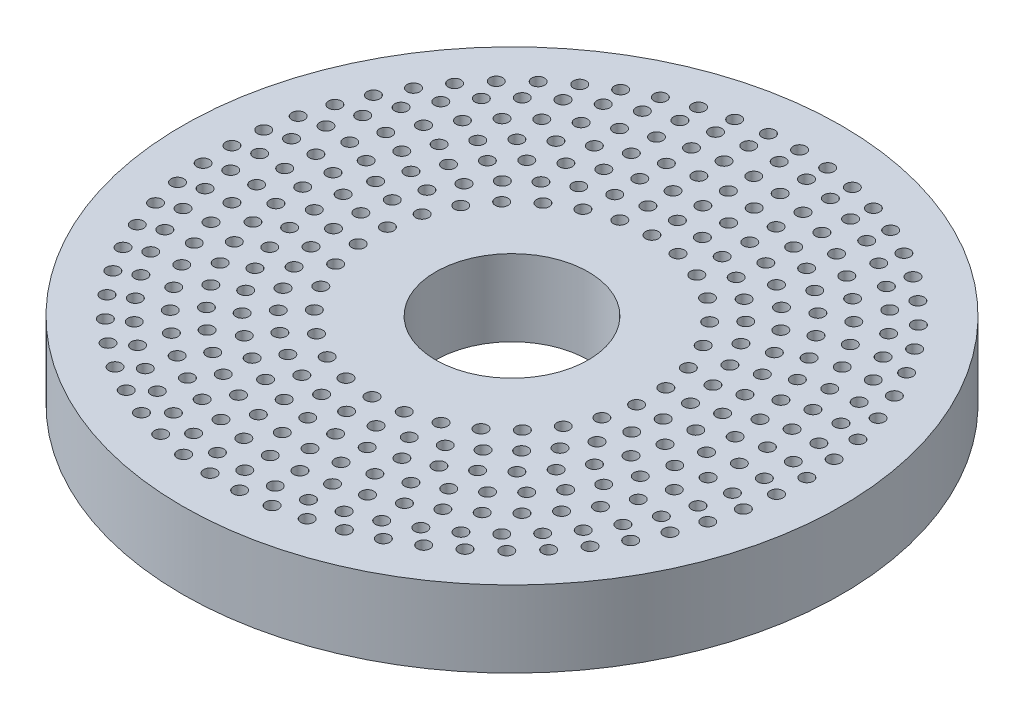
from build123d import *

# Parameters (mm, degrees)
IZIM1_R                     = 129.5
IZIM1_R_2                   = 2.5
Y_KSEKLIK_EKSTR_ZYON2_DEPTH = 30
IZIM2_R                     = 30
KES_EKSTR_ZYON1_DEPTH       = 30


with BuildPart() as part:
    # Çizim1 → Yükseklik-Ekstrüzyon2 (new body)
    with BuildSketch(Plane(origin=(0, 0, 0), x_dir=(1, 0, 0), z_dir=(0, 1, 0))):
        with Locations(Location((0, 0, 0), (0, 0, 270))):
            Circle(IZIM1_R)
        with Locations(Location((0, 55, 0), (0, 0, 270))):
            Circle(IZIM1_R_2, mode=Mode.SUBTRACT)
        with Locations(Location((0, 65, 0), (0, 0, 270))):
            Circle(IZIM1_R_2, mode=Mode.SUBTRACT)
        with Locations(Location((0, 75, 0), (0, 0, 270))):
            Circle(IZIM1_R_2, mode=Mode.SUBTRACT)
        with Locations(Location((0, 85, 0), (0, 0, 270))):
            Circle(IZIM1_R_2, mode=Mode.SUBTRACT)
        with Locations(Location((0, 95, 0), (0, 0, 270))):
            Circle(IZIM1_R_2, mode=Mode.SUBTRACT)
        with Locations(Location((0, 105, 0), (0, 0, 270))):
            Circle(IZIM1_R_2, mode=Mode.SUBTRACT)
        with Locations(Location((0, 113, 0), (0, 0, 270))):
            Circle(IZIM1_R_2, mode=Mode.SUBTRACT)
        with Locations(Location((11.435142995, 53.79811804, 0), (0, 0, 270))):
            Circle(IZIM1_R_2, mode=Mode.SUBTRACT)
        with Locations(Location((22.370515369, 50.24500017, 0), (0, 0, 270))):
            Circle(IZIM1_R_2, mode=Mode.SUBTRACT)
        with Locations(Location((32.328188876, 44.495934691, 0), (0, 0, 270))):
            Circle(IZIM1_R_2, mode=Mode.SUBTRACT)
        with Locations(Location((40.872965401, 36.80218335, 0), (0, 0, 270))):
            Circle(IZIM1_R_2, mode=Mode.SUBTRACT)
        with Locations(Location((47.631397208, 27.5, 0), (0, 0, 270))):
            Circle(IZIM1_R_2, mode=Mode.SUBTRACT)
        with Locations(Location((52.308108396, 16.995934691, 0), (0, 0, 270))):
            Circle(IZIM1_R_2, mode=Mode.SUBTRACT)
        with Locations(Location((54.698704245, 5.74906548, 0), (0, 0, 270))):
            Circle(IZIM1_R_2, mode=Mode.SUBTRACT)
        with Locations(Location((54.698704245, -5.74906548, 0), (0, 0, 270))):
            Circle(IZIM1_R_2, mode=Mode.SUBTRACT)
        with Locations(Location((52.308108396, -16.995934691, 0), (0, 0, 270))):
            Circle(IZIM1_R_2, mode=Mode.SUBTRACT)
        with Locations(Location((47.631397208, -27.5, 0), (0, 0, 270))):
            Circle(IZIM1_R_2, mode=Mode.SUBTRACT)
        with Locations(Location((40.872965401, -36.80218335, 0), (0, 0, 270))):
            Circle(IZIM1_R_2, mode=Mode.SUBTRACT)
        with Locations(Location((32.328188876, -44.495934691, 0), (0, 0, 270))):
            Circle(IZIM1_R_2, mode=Mode.SUBTRACT)
        with Locations(Location((22.370515369, -50.24500017, 0), (0, 0, 270))):
            Circle(IZIM1_R_2, mode=Mode.SUBTRACT)
        with Locations(Location((11.435142995, -53.79811804, 0), (0, 0, 270))):
            Circle(IZIM1_R_2, mode=Mode.SUBTRACT)
        with Locations(Location((0, -55, 0), (0, 0, 270))):
            Circle(IZIM1_R_2, mode=Mode.SUBTRACT)
        with Locations(Location((-11.435142995, -53.79811804, 0), (0, 0, 270))):
            Circle(IZIM1_R_2, mode=Mode.SUBTRACT)
        with Locations(Location((-22.370515369, -50.24500017, 0), (0, 0, 270))):
            Circle(IZIM1_R_2, mode=Mode.SUBTRACT)
        with Locations(Location((-32.328188876, -44.495934691, 0), (0, 0, 270))):
            Circle(IZIM1_R_2, mode=Mode.SUBTRACT)
        with Locations(Location((-40.872965401, -36.80218335, 0), (0, 0, 270))):
            Circle(IZIM1_R_2, mode=Mode.SUBTRACT)
        with Locations(Location((-47.631397208, -27.5, 0), (0, 0, 270))):
            Circle(IZIM1_R_2, mode=Mode.SUBTRACT)
        with Locations(Location((-52.308108396, -16.995934691, 0), (0, 0, 270))):
            Circle(IZIM1_R_2, mode=Mode.SUBTRACT)
        with Locations(Location((-54.698704245, -5.74906548, 0), (0, 0, 270))):
            Circle(IZIM1_R_2, mode=Mode.SUBTRACT)
        with Locations(Location((-54.698704245, 5.74906548, 0), (0, 0, 270))):
            Circle(IZIM1_R_2, mode=Mode.SUBTRACT)
        with Locations(Location((-52.308108396, 16.995934691, 0), (0, 0, 270))):
            Circle(IZIM1_R_2, mode=Mode.SUBTRACT)
        with Locations(Location((-47.631397208, 27.5, 0), (0, 0, 270))):
            Circle(IZIM1_R_2, mode=Mode.SUBTRACT)
        with Locations(Location((-40.872965401, 36.80218335, 0), (0, 0, 270))):
            Circle(IZIM1_R_2, mode=Mode.SUBTRACT)
        with Locations(Location((-32.328188876, 44.495934691, 0), (0, 0, 270))):
            Circle(IZIM1_R_2, mode=Mode.SUBTRACT)
        with Locations(Location((-22.370515369, 50.24500017, 0), (0, 0, 270))):
            Circle(IZIM1_R_2, mode=Mode.SUBTRACT)
        with Locations(Location((-11.435142995, 53.79811804, 0), (0, 0, 270))):
            Circle(IZIM1_R_2, mode=Mode.SUBTRACT)
        with Locations(Location((10.698648368, 64.113484721, 0), (0, 0, 270))):
            Circle(IZIM1_R_2, mode=Mode.SUBTRACT)
        with Locations(Location((21.105465498, 61.478120711, 0), (0, 0, 270))):
            Circle(IZIM1_R_2, mode=Mode.SUBTRACT)
        with Locations(Location((30.936580547, 57.165793828, 0), (0, 0, 270))):
            Circle(IZIM1_R_2, mode=Mode.SUBTRACT)
        with Locations(Location((39.923826325, 51.294133111, 0), (0, 0, 270))):
            Circle(IZIM1_R_2, mode=Mode.SUBTRACT)
        with Locations(Location((47.822054194, 44.023302156, 0), (0, 0, 270))):
            Circle(IZIM1_R_2, mode=Mode.SUBTRACT)
        with Locations(Location((54.415821087, 35.551630278, 0), (0, 0, 270))):
            Circle(IZIM1_R_2, mode=Mode.SUBTRACT)
        with Locations(Location((59.525266233, 26.110202602, 0), (0, 0, 270))):
            Circle(IZIM1_R_2, mode=Mode.SUBTRACT)
        with Locations(Location((63.011017286, 15.956556664, 0), (0, 0, 270))):
            Circle(IZIM1_R_2, mode=Mode.SUBTRACT)
        with Locations(Location((64.777992045, 5.367657456, 0), (0, 0, 270))):
            Circle(IZIM1_R_2, mode=Mode.SUBTRACT)
        with Locations(Location((64.777992045, -5.367657456, 0), (0, 0, 270))):
            Circle(IZIM1_R_2, mode=Mode.SUBTRACT)
        with Locations(Location((63.011017286, -15.956556664, 0), (0, 0, 270))):
            Circle(IZIM1_R_2, mode=Mode.SUBTRACT)
        with Locations(Location((59.525266233, -26.110202602, 0), (0, 0, 270))):
            Circle(IZIM1_R_2, mode=Mode.SUBTRACT)
        with Locations(Location((54.415821087, -35.551630278, 0), (0, 0, 270))):
            Circle(IZIM1_R_2, mode=Mode.SUBTRACT)
        with Locations(Location((47.822054194, -44.023302156, 0), (0, 0, 270))):
            Circle(IZIM1_R_2, mode=Mode.SUBTRACT)
        with Locations(Location((39.923826325, -51.294133111, 0), (0, 0, 270))):
            Circle(IZIM1_R_2, mode=Mode.SUBTRACT)
        with Locations(Location((30.936580547, -57.165793828, 0), (0, 0, 270))):
            Circle(IZIM1_R_2, mode=Mode.SUBTRACT)
        with Locations(Location((21.105465498, -61.478120711, 0), (0, 0, 270))):
            Circle(IZIM1_R_2, mode=Mode.SUBTRACT)
        with Locations(Location((10.698648368, -64.113484721, 0), (0, 0, 270))):
            Circle(IZIM1_R_2, mode=Mode.SUBTRACT)
        with Locations(Location((0, -65, 0), (0, 0, 270))):
            Circle(IZIM1_R_2, mode=Mode.SUBTRACT)
        with Locations(Location((-10.698648368, -64.113484721, 0), (0, 0, 270))):
            Circle(IZIM1_R_2, mode=Mode.SUBTRACT)
        with Locations(Location((-21.105465498, -61.478120711, 0), (0, 0, 270))):
            Circle(IZIM1_R_2, mode=Mode.SUBTRACT)
        with Locations(Location((-30.936580547, -57.165793828, 0), (0, 0, 270))):
            Circle(IZIM1_R_2, mode=Mode.SUBTRACT)
        with Locations(Location((-39.923826325, -51.294133111, 0), (0, 0, 270))):
            Circle(IZIM1_R_2, mode=Mode.SUBTRACT)
        with Locations(Location((-47.822054194, -44.023302156, 0), (0, 0, 270))):
            Circle(IZIM1_R_2, mode=Mode.SUBTRACT)
        with Locations(Location((-54.415821087, -35.551630278, 0), (0, 0, 270))):
            Circle(IZIM1_R_2, mode=Mode.SUBTRACT)
        with Locations(Location((-59.525266233, -26.110202602, 0), (0, 0, 270))):
            Circle(IZIM1_R_2, mode=Mode.SUBTRACT)
        with Locations(Location((-63.011017286, -15.956556664, 0), (0, 0, 270))):
            Circle(IZIM1_R_2, mode=Mode.SUBTRACT)
        with Locations(Location((-64.777992045, -5.367657456, 0), (0, 0, 270))):
            Circle(IZIM1_R_2, mode=Mode.SUBTRACT)
        with Locations(Location((-64.777992045, 5.367657456, 0), (0, 0, 270))):
            Circle(IZIM1_R_2, mode=Mode.SUBTRACT)
        with Locations(Location((-63.011017286, 15.956556664, 0), (0, 0, 270))):
            Circle(IZIM1_R_2, mode=Mode.SUBTRACT)
        with Locations(Location((-59.525266233, 26.110202602, 0), (0, 0, 270))):
            Circle(IZIM1_R_2, mode=Mode.SUBTRACT)
        with Locations(Location((-54.415821087, 35.551630278, 0), (0, 0, 270))):
            Circle(IZIM1_R_2, mode=Mode.SUBTRACT)
        with Locations(Location((-47.822054194, 44.023302156, 0), (0, 0, 270))):
            Circle(IZIM1_R_2, mode=Mode.SUBTRACT)
        with Locations(Location((-39.923826325, 51.294133111, 0), (0, 0, 270))):
            Circle(IZIM1_R_2, mode=Mode.SUBTRACT)
        with Locations(Location((-30.936580547, 57.165793828, 0), (0, 0, 270))):
            Circle(IZIM1_R_2, mode=Mode.SUBTRACT)
        with Locations(Location((-21.105465498, 61.478120711, 0), (0, 0, 270))):
            Circle(IZIM1_R_2, mode=Mode.SUBTRACT)
        with Locations(Location((-10.698648368, 64.113484721, 0), (0, 0, 270))):
            Circle(IZIM1_R_2, mode=Mode.SUBTRACT)
        with Locations(Location((10.92008758, 74.200752606, 0), (0, 0, 270))):
            Circle(IZIM1_R_2, mode=Mode.SUBTRACT)
        with Locations(Location((21.607432452, 71.820044993, 0), (0, 0, 270))):
            Circle(IZIM1_R_2, mode=Mode.SUBTRACT)
        with Locations(Location((31.834252416, 67.908617812, 0), (0, 0, 270))):
            Circle(IZIM1_R_2, mode=Mode.SUBTRACT)
        with Locations(Location((41.382580558, 62.549836342, 0), (0, 0, 270))):
            Circle(IZIM1_R_2, mode=Mode.SUBTRACT)
        with Locations(Location((50.048910842, 55.857913706, 0), (0, 0, 270))):
            Circle(IZIM1_R_2, mode=Mode.SUBTRACT)
        with Locations(Location((57.648535483, 47.975476617, 0), (0, 0, 270))):
            Circle(IZIM1_R_2, mode=Mode.SUBTRACT)
        with Locations(Location((64.019481678, 39.070525537, 0), (0, 0, 270))):
            Circle(IZIM1_R_2, mode=Mode.SUBTRACT)
        with Locations(Location((69.025963768, 29.332854037, 0), (0, 0, 270))):
            Circle(IZIM1_R_2, mode=Mode.SUBTRACT)
        with Locations(Location((72.561277279, 18.970003679, 0), (0, 0, 270))):
            Circle(IZIM1_R_2, mode=Mode.SUBTRACT)
        with Locations(Location((74.550073143, 8.202840628, 0), (0, 0, 270))):
            Circle(IZIM1_R_2, mode=Mode.SUBTRACT)
        with Locations(Location((74.949963628, -2.739151729, 0), (0, 0, 270))):
            Circle(IZIM1_R_2, mode=Mode.SUBTRACT)
        with Locations(Location((73.752425762, -13.622763823, 0), (0, 0, 270))):
            Circle(IZIM1_R_2, mode=Mode.SUBTRACT)
        with Locations(Location((70.982982987, -24.216030358, 0), (0, 0, 270))):
            Circle(IZIM1_R_2, mode=Mode.SUBTRACT)
        with Locations(Location((66.700661166, -34.293174248, 0), (0, 0, 270))):
            Circle(IZIM1_R_2, mode=Mode.SUBTRACT)
        with Locations(Location((60.996730555, -43.639418667, 0), (0, 0, 270))):
            Circle(IZIM1_R_2, mode=Mode.SUBTRACT)
        with Locations(Location((53.992760532, -52.055564642, 0), (0, 0, 270))):
            Circle(IZIM1_R_2, mode=Mode.SUBTRACT)
        with Locations(Location((45.838028557, -59.362236632, 0), (0, 0, 270))):
            Circle(IZIM1_R_2, mode=Mode.SUBTRACT)
        with Locations(Location((36.706338586, -65.403705611, 0), (0, 0, 270))):
            Circle(IZIM1_R_2, mode=Mode.SUBTRACT)
        with Locations(Location((26.792316735, -70.051208155, 0), (0, 0, 270))):
            Circle(IZIM1_R_2, mode=Mode.SUBTRACT)
        with Locations(Location((16.307263169, -73.205690817, 0), (0, 0, 270))):
            Circle(IZIM1_R_2, mode=Mode.SUBTRACT)
        with Locations(Location((5.4746486, -74.799921275, 0), (0, 0, 270))):
            Circle(IZIM1_R_2, mode=Mode.SUBTRACT)
        with Locations(Location((-5.4746486, -74.799921275, 0), (0, 0, 270))):
            Circle(IZIM1_R_2, mode=Mode.SUBTRACT)
        with Locations(Location((-16.307263169, -73.205690817, 0), (0, 0, 270))):
            Circle(IZIM1_R_2, mode=Mode.SUBTRACT)
        with Locations(Location((-26.792316735, -70.051208155, 0), (0, 0, 270))):
            Circle(IZIM1_R_2, mode=Mode.SUBTRACT)
        with Locations(Location((-36.706338586, -65.403705611, 0), (0, 0, 270))):
            Circle(IZIM1_R_2, mode=Mode.SUBTRACT)
        with Locations(Location((-45.838028557, -59.362236632, 0), (0, 0, 270))):
            Circle(IZIM1_R_2, mode=Mode.SUBTRACT)
        with Locations(Location((-53.992760532, -52.055564642, 0), (0, 0, 270))):
            Circle(IZIM1_R_2, mode=Mode.SUBTRACT)
        with Locations(Location((-60.996730555, -43.639418667, 0), (0, 0, 270))):
            Circle(IZIM1_R_2, mode=Mode.SUBTRACT)
        with Locations(Location((-66.700661166, -34.293174248, 0), (0, 0, 270))):
            Circle(IZIM1_R_2, mode=Mode.SUBTRACT)
        with Locations(Location((-70.982982987, -24.216030358, 0), (0, 0, 270))):
            Circle(IZIM1_R_2, mode=Mode.SUBTRACT)
        with Locations(Location((-73.752425762, -13.622763823, 0), (0, 0, 270))):
            Circle(IZIM1_R_2, mode=Mode.SUBTRACT)
        with Locations(Location((-74.949963628, -2.739151729, 0), (0, 0, 270))):
            Circle(IZIM1_R_2, mode=Mode.SUBTRACT)
        with Locations(Location((-74.550073143, 8.202840628, 0), (0, 0, 270))):
            Circle(IZIM1_R_2, mode=Mode.SUBTRACT)
        with Locations(Location((-72.561277279, 18.970003679, 0), (0, 0, 270))):
            Circle(IZIM1_R_2, mode=Mode.SUBTRACT)
        with Locations(Location((-69.025963768, 29.332854037, 0), (0, 0, 270))):
            Circle(IZIM1_R_2, mode=Mode.SUBTRACT)
        with Locations(Location((-64.019481678, 39.070525537, 0), (0, 0, 270))):
            Circle(IZIM1_R_2, mode=Mode.SUBTRACT)
        with Locations(Location((-57.648535483, 47.975476617, 0), (0, 0, 270))):
            Circle(IZIM1_R_2, mode=Mode.SUBTRACT)
        with Locations(Location((-50.048910842, 55.857913706, 0), (0, 0, 270))):
            Circle(IZIM1_R_2, mode=Mode.SUBTRACT)
        with Locations(Location((-41.382580558, 62.549836342, 0), (0, 0, 270))):
            Circle(IZIM1_R_2, mode=Mode.SUBTRACT)
        with Locations(Location((-31.834252416, 67.908617812, 0), (0, 0, 270))):
            Circle(IZIM1_R_2, mode=Mode.SUBTRACT)
        with Locations(Location((-21.607432452, 71.820044993, 0), (0, 0, 270))):
            Circle(IZIM1_R_2, mode=Mode.SUBTRACT)
        with Locations(Location((-10.92008758, 74.200752606, 0), (0, 0, 270))):
            Circle(IZIM1_R_2, mode=Mode.SUBTRACT)
        with Locations(Location((10.869558743, 84.302151175, 0), (0, 0, 270))):
            Circle(IZIM1_R_2, mode=Mode.SUBTRACT)
        with Locations(Location((21.560639632, 82.220063358, 0), (0, 0, 270))):
            Circle(IZIM1_R_2, mode=Mode.SUBTRACT)
        with Locations(Location((31.897695415, 78.787924374, 0), (0, 0, 270))):
            Circle(IZIM1_R_2, mode=Mode.SUBTRACT)
        with Locations(Location((41.71099192, 74.06208985, 0), (0, 0, 270))):
            Circle(IZIM1_R_2, mode=Mode.SUBTRACT)
        with Locations(Location((50.839395092, 68.120157859, 0), (0, 0, 270))):
            Circle(IZIM1_R_2, mode=Mode.SUBTRACT)
        with Locations(Location((59.133016801, 61.059694758, 0), (0, 0, 270))):
            Circle(IZIM1_R_2, mode=Mode.SUBTRACT)
        with Locations(Location((66.45567601, 52.996633158, 0), (0, 0, 270))):
            Circle(IZIM1_R_2, mode=Mode.SUBTRACT)
        with Locations(Location((72.687134855, 44.063368306, 0), (0, 0, 270))):
            Circle(IZIM1_R_2, mode=Mode.SUBTRACT)
        with Locations(Location((77.725072956, 34.406584165, 0), (0, 0, 270))):
            Circle(IZIM1_R_2, mode=Mode.SUBTRACT)
        with Locations(Location((81.486767508, 24.184844864, 0), (0, 0, 270))):
            Circle(IZIM1_R_2, mode=Mode.SUBTRACT)
        with Locations(Location((83.91045159, 13.565991078, 0), (0, 0, 270))):
            Circle(IZIM1_R_2, mode=Mode.SUBTRACT)
        with Locations(Location((84.956328377, 2.724384094, 0), (0, 0, 270))):
            Circle(IZIM1_R_2, mode=Mode.SUBTRACT)
        with Locations(Location((84.607224601, -8.161957202, 0), (0, 0, 270))):
            Circle(IZIM1_R_2, mode=Mode.SUBTRACT)
        with Locations(Location((82.868872535, -18.914279386, 0), (0, 0, 270))):
            Circle(IZIM1_R_2, mode=Mode.SUBTRACT)
        with Locations(Location((79.769815874, -29.356029626, 0), (0, 0, 270))):
            Circle(IZIM1_R_2, mode=Mode.SUBTRACT)
        with Locations(Location((75.360941042, -39.31575467, 0), (0, 0, 270))):
            Circle(IZIM1_R_2, mode=Mode.SUBTRACT)
        with Locations(Location((69.714641641, -48.62991611, 0), (0, 0, 270))):
            Circle(IZIM1_R_2, mode=Mode.SUBTRACT)
        with Locations(Location((62.923629751, -57.145575672, 0), (0, 0, 270))):
            Circle(IZIM1_R_2, mode=Mode.SUBTRACT)
        with Locations(Location((55.099413601, -64.722906461, 0), (0, 0, 270))):
            Circle(IZIM1_R_2, mode=Mode.SUBTRACT)
        with Locations(Location((46.370466603, -71.237488916, 0), (0, 0, 270))):
            Circle(IZIM1_R_2, mode=Mode.SUBTRACT)
        with Locations(Location((36.880117825, -76.582353772, 0), (0, 0, 270))):
            Circle(IZIM1_R_2, mode=Mode.SUBTRACT)
        with Locations(Location((26.784198532, -80.669738496, 0), (0, 0, 270))):
            Circle(IZIM1_R_2, mode=Mode.SUBTRACT)
        with Locations(Location((16.24848344, -83.432528344, 0), (0, 0, 270))):
            Circle(IZIM1_R_2, mode=Mode.SUBTRACT)
        with Locations(Location((5.445968698, -84.825358384, 0), (0, 0, 270))):
            Circle(IZIM1_R_2, mode=Mode.SUBTRACT)
        with Locations(Location((-5.445968698, -84.825358384, 0), (0, 0, 270))):
            Circle(IZIM1_R_2, mode=Mode.SUBTRACT)
        with Locations(Location((-16.24848344, -83.432528344, 0), (0, 0, 270))):
            Circle(IZIM1_R_2, mode=Mode.SUBTRACT)
        with Locations(Location((-26.784198532, -80.669738496, 0), (0, 0, 270))):
            Circle(IZIM1_R_2, mode=Mode.SUBTRACT)
        with Locations(Location((-36.880117825, -76.582353772, 0), (0, 0, 270))):
            Circle(IZIM1_R_2, mode=Mode.SUBTRACT)
        with Locations(Location((-46.370466603, -71.237488916, 0), (0, 0, 270))):
            Circle(IZIM1_R_2, mode=Mode.SUBTRACT)
        with Locations(Location((-55.099413601, -64.722906461, 0), (0, 0, 270))):
            Circle(IZIM1_R_2, mode=Mode.SUBTRACT)
        with Locations(Location((-62.923629751, -57.145575672, 0), (0, 0, 270))):
            Circle(IZIM1_R_2, mode=Mode.SUBTRACT)
        with Locations(Location((-69.714641641, -48.62991611, 0), (0, 0, 270))):
            Circle(IZIM1_R_2, mode=Mode.SUBTRACT)
        with Locations(Location((-75.360941042, -39.31575467, 0), (0, 0, 270))):
            Circle(IZIM1_R_2, mode=Mode.SUBTRACT)
        with Locations(Location((-79.769815874, -29.356029626, 0), (0, 0, 270))):
            Circle(IZIM1_R_2, mode=Mode.SUBTRACT)
        with Locations(Location((-82.868872535, -18.914279386, 0), (0, 0, 270))):
            Circle(IZIM1_R_2, mode=Mode.SUBTRACT)
        with Locations(Location((-84.607224601, -8.161957202, 0), (0, 0, 270))):
            Circle(IZIM1_R_2, mode=Mode.SUBTRACT)
        with Locations(Location((-84.956328377, 2.724384094, 0), (0, 0, 270))):
            Circle(IZIM1_R_2, mode=Mode.SUBTRACT)
        with Locations(Location((-83.91045159, 13.565991078, 0), (0, 0, 270))):
            Circle(IZIM1_R_2, mode=Mode.SUBTRACT)
        with Locations(Location((-81.486767508, 24.184844864, 0), (0, 0, 270))):
            Circle(IZIM1_R_2, mode=Mode.SUBTRACT)
        with Locations(Location((-77.725072956, 34.406584165, 0), (0, 0, 270))):
            Circle(IZIM1_R_2, mode=Mode.SUBTRACT)
        with Locations(Location((-72.687134855, 44.063368306, 0), (0, 0, 270))):
            Circle(IZIM1_R_2, mode=Mode.SUBTRACT)
        with Locations(Location((-66.45567601, 52.996633158, 0), (0, 0, 270))):
            Circle(IZIM1_R_2, mode=Mode.SUBTRACT)
        with Locations(Location((-59.133016801, 61.059694758, 0), (0, 0, 270))):
            Circle(IZIM1_R_2, mode=Mode.SUBTRACT)
        with Locations(Location((-50.839395092, 68.120157859, 0), (0, 0, 270))):
            Circle(IZIM1_R_2, mode=Mode.SUBTRACT)
        with Locations(Location((-41.71099192, 74.06208985, 0), (0, 0, 270))):
            Circle(IZIM1_R_2, mode=Mode.SUBTRACT)
        with Locations(Location((-31.897695415, 78.787924374, 0), (0, 0, 270))):
            Circle(IZIM1_R_2, mode=Mode.SUBTRACT)
        with Locations(Location((-21.560639632, 82.220063358, 0), (0, 0, 270))):
            Circle(IZIM1_R_2, mode=Mode.SUBTRACT)
        with Locations(Location((-10.869558743, 84.302151175, 0), (0, 0, 270))):
            Circle(IZIM1_R_2, mode=Mode.SUBTRACT)
        with Locations(Location((11.028826842, 94.357643985, 0), (0, 0, 270))):
            Circle(IZIM1_R_2, mode=Mode.SUBTRACT)
        with Locations(Location((21.908507721, 92.439262705, 0), (0, 0, 270))):
            Circle(IZIM1_R_2, mode=Mode.SUBTRACT)
        with Locations(Location((32.491913616, 89.270798975, 0), (0, 0, 270))):
            Circle(IZIM1_R_2, mode=Mode.SUBTRACT)
        with Locations(Location((42.635922119, 84.895100831, 0), (0, 0, 270))):
            Circle(IZIM1_R_2, mode=Mode.SUBTRACT)
        with Locations(Location((52.203352917, 79.371342084, 0), (0, 0, 270))):
            Circle(IZIM1_R_2, mode=Mode.SUBTRACT)
        with Locations(Location((61.06482292, 72.774222096, 0), (0, 0, 270))):
            Circle(IZIM1_R_2, mode=Mode.SUBTRACT)
        with Locations(Location((69.100495949, 65.192955598, 0), (0, 0, 270))):
            Circle(IZIM1_R_2, mode=Mode.SUBTRACT)
        with Locations(Location((76.201703312, 56.730066212, 0), (0, 0, 270))):
            Circle(IZIM1_R_2, mode=Mode.SUBTRACT)
        with Locations(Location((82.27241336, 47.5, 0), (0, 0, 270))):
            Circle(IZIM1_R_2, mode=Mode.SUBTRACT)
        with Locations(Location((87.230530154, 37.627577774, 0), (0, 0, 270))):
            Circle(IZIM1_R_2, mode=Mode.SUBTRACT)
        with Locations(Location((91.00900367, 27.246307108, 0), (0, 0, 270))):
            Circle(IZIM1_R_2, mode=Mode.SUBTRACT)
        with Locations(Location((93.556736536, 16.496576878, 0), (0, 0, 270))):
            Circle(IZIM1_R_2, mode=Mode.SUBTRACT)
        with Locations(Location((94.839275036, 5.523758747, 0), (0, 0, 270))):
            Circle(IZIM1_R_2, mode=Mode.SUBTRACT)
        with Locations(Location((94.839275036, -5.523758746, 0), (0, 0, 270))):
            Circle(IZIM1_R_2, mode=Mode.SUBTRACT)
        with Locations(Location((93.556736536, -16.496576878, 0), (0, 0, 270))):
            Circle(IZIM1_R_2, mode=Mode.SUBTRACT)
        with Locations(Location((91.00900367, -27.246307108, 0), (0, 0, 270))):
            Circle(IZIM1_R_2, mode=Mode.SUBTRACT)
        with Locations(Location((87.230530154, -37.627577774, 0), (0, 0, 270))):
            Circle(IZIM1_R_2, mode=Mode.SUBTRACT)
        with Locations(Location((82.27241336, -47.5, 0), (0, 0, 270))):
            Circle(IZIM1_R_2, mode=Mode.SUBTRACT)
        with Locations(Location((76.201703312, -56.730066212, 0), (0, 0, 270))):
            Circle(IZIM1_R_2, mode=Mode.SUBTRACT)
        with Locations(Location((69.100495949, -65.192955598, 0), (0, 0, 270))):
            Circle(IZIM1_R_2, mode=Mode.SUBTRACT)
        with Locations(Location((61.06482292, -72.774222096, 0), (0, 0, 270))):
            Circle(IZIM1_R_2, mode=Mode.SUBTRACT)
        with Locations(Location((52.203352917, -79.371342084, 0), (0, 0, 270))):
            Circle(IZIM1_R_2, mode=Mode.SUBTRACT)
        with Locations(Location((42.635922119, -84.895100831, 0), (0, 0, 270))):
            Circle(IZIM1_R_2, mode=Mode.SUBTRACT)
        with Locations(Location((32.491913616, -89.270798975, 0), (0, 0, 270))):
            Circle(IZIM1_R_2, mode=Mode.SUBTRACT)
        with Locations(Location((21.908507721, -92.439262705, 0), (0, 0, 270))):
            Circle(IZIM1_R_2, mode=Mode.SUBTRACT)
        with Locations(Location((11.028826842, -94.357643985, 0), (0, 0, 270))):
            Circle(IZIM1_R_2, mode=Mode.SUBTRACT)
        with Locations(Location((0, -95, 0), (0, 0, 270))):
            Circle(IZIM1_R_2, mode=Mode.SUBTRACT)
        with Locations(Location((-11.028826842, -94.357643985, 0), (0, 0, 270))):
            Circle(IZIM1_R_2, mode=Mode.SUBTRACT)
        with Locations(Location((-21.908507721, -92.439262705, 0), (0, 0, 270))):
            Circle(IZIM1_R_2, mode=Mode.SUBTRACT)
        with Locations(Location((-32.491913616, -89.270798975, 0), (0, 0, 270))):
            Circle(IZIM1_R_2, mode=Mode.SUBTRACT)
        with Locations(Location((-42.635922119, -84.895100831, 0), (0, 0, 270))):
            Circle(IZIM1_R_2, mode=Mode.SUBTRACT)
        with Locations(Location((-52.203352917, -79.371342084, 0), (0, 0, 270))):
            Circle(IZIM1_R_2, mode=Mode.SUBTRACT)
        with Locations(Location((-61.06482292, -72.774222096, 0), (0, 0, 270))):
            Circle(IZIM1_R_2, mode=Mode.SUBTRACT)
        with Locations(Location((-69.100495949, -65.192955598, 0), (0, 0, 270))):
            Circle(IZIM1_R_2, mode=Mode.SUBTRACT)
        with Locations(Location((-76.201703312, -56.730066212, 0), (0, 0, 270))):
            Circle(IZIM1_R_2, mode=Mode.SUBTRACT)
        with Locations(Location((-82.272413359, -47.5, 0), (0, 0, 270))):
            Circle(IZIM1_R_2, mode=Mode.SUBTRACT)
        with Locations(Location((-87.230530154, -37.627577774, 0), (0, 0, 270))):
            Circle(IZIM1_R_2, mode=Mode.SUBTRACT)
        with Locations(Location((-91.00900367, -27.246307108, 0), (0, 0, 270))):
            Circle(IZIM1_R_2, mode=Mode.SUBTRACT)
        with Locations(Location((-93.556736536, -16.496576878, 0), (0, 0, 270))):
            Circle(IZIM1_R_2, mode=Mode.SUBTRACT)
        with Locations(Location((-94.839275036, -5.523758747, 0), (0, 0, 270))):
            Circle(IZIM1_R_2, mode=Mode.SUBTRACT)
        with Locations(Location((-94.839275036, 5.523758746, 0), (0, 0, 270))):
            Circle(IZIM1_R_2, mode=Mode.SUBTRACT)
        with Locations(Location((-93.556736536, 16.496576878, 0), (0, 0, 270))):
            Circle(IZIM1_R_2, mode=Mode.SUBTRACT)
        with Locations(Location((-91.00900367, 27.246307108, 0), (0, 0, 270))):
            Circle(IZIM1_R_2, mode=Mode.SUBTRACT)
        with Locations(Location((-87.230530154, 37.627577774, 0), (0, 0, 270))):
            Circle(IZIM1_R_2, mode=Mode.SUBTRACT)
        with Locations(Location((-82.27241336, 47.5, 0), (0, 0, 270))):
            Circle(IZIM1_R_2, mode=Mode.SUBTRACT)
        with Locations(Location((-76.201703312, 56.730066212, 0), (0, 0, 270))):
            Circle(IZIM1_R_2, mode=Mode.SUBTRACT)
        with Locations(Location((-69.100495949, 65.192955598, 0), (0, 0, 270))):
            Circle(IZIM1_R_2, mode=Mode.SUBTRACT)
        with Locations(Location((-61.06482292, 72.774222096, 0), (0, 0, 270))):
            Circle(IZIM1_R_2, mode=Mode.SUBTRACT)
        with Locations(Location((-52.203352917, 79.371342084, 0), (0, 0, 270))):
            Circle(IZIM1_R_2, mode=Mode.SUBTRACT)
        with Locations(Location((-42.635922119, 84.895100831, 0), (0, 0, 270))):
            Circle(IZIM1_R_2, mode=Mode.SUBTRACT)
        with Locations(Location((-32.491913616, 89.270798975, 0), (0, 0, 270))):
            Circle(IZIM1_R_2, mode=Mode.SUBTRACT)
        with Locations(Location((-21.908507721, 92.439262705, 0), (0, 0, 270))):
            Circle(IZIM1_R_2, mode=Mode.SUBTRACT)
        with Locations(Location((-11.028826842, 94.357643985, 0), (0, 0, 270))):
            Circle(IZIM1_R_2, mode=Mode.SUBTRACT)
        with Locations(Location((11.352496935, 104.384485501, 0), (0, 0, 270))):
            Circle(IZIM1_R_2, mode=Mode.SUBTRACT)
        with Locations(Location((22.571896222, 102.54515835, 0), (0, 0, 270))):
            Circle(IZIM1_R_2, mode=Mode.SUBTRACT)
        with Locations(Location((33.526660664, 99.503582974, 0), (0, 0, 270))):
            Circle(IZIM1_R_2, mode=Mode.SUBTRACT)
        with Locations(Location((44.088355664, 95.295419065, 0), (0, 0, 270))):
            Circle(IZIM1_R_2, mode=Mode.SUBTRACT)
        with Locations(Location((54.133155004, 89.970003498, 0), (0, 0, 270))):
            Circle(IZIM1_R_2, mode=Mode.SUBTRACT)
        with Locations(Location((63.543292595, 83.589771899, 0), (0, 0, 270))):
            Circle(IZIM1_R_2, mode=Mode.SUBTRACT)
        with Locations(Location((72.20844318, 76.229526652, 0), (0, 0, 270))):
            Circle(IZIM1_R_2, mode=Mode.SUBTRACT)
        with Locations(Location((80.027015788, 67.975559902, 0), (0, 0, 270))):
            Circle(IZIM1_R_2, mode=Mode.SUBTRACT)
        with Locations(Location((86.907344806, 58.924641863, 0), (0, 0, 270))):
            Circle(IZIM1_R_2, mode=Mode.SUBTRACT)
        with Locations(Location((92.768764667, 49.182886273, 0), (0, 0, 270))):
            Circle(IZIM1_R_2, mode=Mode.SUBTRACT)
        with Locations(Location((97.542555581, 38.864506311, 0), (0, 0, 270))):
            Circle(IZIM1_R_2, mode=Mode.SUBTRACT)
        with Locations(Location((101.172749215, 28.090475546, 0), (0, 0, 270))):
            Circle(IZIM1_R_2, mode=Mode.SUBTRACT)
        with Locations(Location((103.616784867, 16.987109638, 0), (0, 0, 270))):
            Circle(IZIM1_R_2, mode=Mode.SUBTRACT)
        with Locations(Location((104.846008454, 5.684585401, 0), (0, 0, 270))):
            Circle(IZIM1_R_2, mode=Mode.SUBTRACT)
        with Locations(Location((104.846008454, -5.684585401, 0), (0, 0, 270))):
            Circle(IZIM1_R_2, mode=Mode.SUBTRACT)
        with Locations(Location((103.616784867, -16.987109638, 0), (0, 0, 270))):
            Circle(IZIM1_R_2, mode=Mode.SUBTRACT)
        with Locations(Location((101.172749215, -28.090475546, 0), (0, 0, 270))):
            Circle(IZIM1_R_2, mode=Mode.SUBTRACT)
        with Locations(Location((97.542555581, -38.864506311, 0), (0, 0, 270))):
            Circle(IZIM1_R_2, mode=Mode.SUBTRACT)
        with Locations(Location((92.768764667, -49.182886273, 0), (0, 0, 270))):
            Circle(IZIM1_R_2, mode=Mode.SUBTRACT)
        with Locations(Location((86.907344806, -58.924641863, 0), (0, 0, 270))):
            Circle(IZIM1_R_2, mode=Mode.SUBTRACT)
        with Locations(Location((80.027015788, -67.975559902, 0), (0, 0, 270))):
            Circle(IZIM1_R_2, mode=Mode.SUBTRACT)
        with Locations(Location((72.20844318, -76.229526652, 0), (0, 0, 270))):
            Circle(IZIM1_R_2, mode=Mode.SUBTRACT)
        with Locations(Location((63.543292595, -83.589771899, 0), (0, 0, 270))):
            Circle(IZIM1_R_2, mode=Mode.SUBTRACT)
        with Locations(Location((54.133155004, -89.970003498, 0), (0, 0, 270))):
            Circle(IZIM1_R_2, mode=Mode.SUBTRACT)
        with Locations(Location((44.088355664, -95.295419065, 0), (0, 0, 270))):
            Circle(IZIM1_R_2, mode=Mode.SUBTRACT)
        with Locations(Location((33.526660664, -99.503582974, 0), (0, 0, 270))):
            Circle(IZIM1_R_2, mode=Mode.SUBTRACT)
        with Locations(Location((22.571896222, -102.54515835, 0), (0, 0, 270))):
            Circle(IZIM1_R_2, mode=Mode.SUBTRACT)
        with Locations(Location((11.352496935, -104.384485501, 0), (0, 0, 270))):
            Circle(IZIM1_R_2, mode=Mode.SUBTRACT)
        with Locations(Location((0, -105, 0), (0, 0, 270))):
            Circle(IZIM1_R_2, mode=Mode.SUBTRACT)
        with Locations(Location((-11.352496934, -104.384485501, 0), (0, 0, 270))):
            Circle(IZIM1_R_2, mode=Mode.SUBTRACT)
        with Locations(Location((-22.571896222, -102.54515835, 0), (0, 0, 270))):
            Circle(IZIM1_R_2, mode=Mode.SUBTRACT)
        with Locations(Location((-33.526660664, -99.503582974, 0), (0, 0, 270))):
            Circle(IZIM1_R_2, mode=Mode.SUBTRACT)
        with Locations(Location((-44.088355664, -95.295419065, 0), (0, 0, 270))):
            Circle(IZIM1_R_2, mode=Mode.SUBTRACT)
        with Locations(Location((-54.133155004, -89.970003498, 0), (0, 0, 270))):
            Circle(IZIM1_R_2, mode=Mode.SUBTRACT)
        with Locations(Location((-63.543292595, -83.589771899, 0), (0, 0, 270))):
            Circle(IZIM1_R_2, mode=Mode.SUBTRACT)
        with Locations(Location((-72.20844318, -76.229526652, 0), (0, 0, 270))):
            Circle(IZIM1_R_2, mode=Mode.SUBTRACT)
        with Locations(Location((-80.027015788, -67.975559902, 0), (0, 0, 270))):
            Circle(IZIM1_R_2, mode=Mode.SUBTRACT)
        with Locations(Location((-86.907344806, -58.924641863, 0), (0, 0, 270))):
            Circle(IZIM1_R_2, mode=Mode.SUBTRACT)
        with Locations(Location((-92.768764667, -49.182886273, 0), (0, 0, 270))):
            Circle(IZIM1_R_2, mode=Mode.SUBTRACT)
        with Locations(Location((-97.542555581, -38.864506311, 0), (0, 0, 270))):
            Circle(IZIM1_R_2, mode=Mode.SUBTRACT)
        with Locations(Location((-101.172749215, -28.090475546, 0), (0, 0, 270))):
            Circle(IZIM1_R_2, mode=Mode.SUBTRACT)
        with Locations(Location((-103.616784867, -16.987109638, 0), (0, 0, 270))):
            Circle(IZIM1_R_2, mode=Mode.SUBTRACT)
        with Locations(Location((-104.846008454, -5.684585401, 0), (0, 0, 270))):
            Circle(IZIM1_R_2, mode=Mode.SUBTRACT)
        with Locations(Location((-104.846008454, 5.684585401, 0), (0, 0, 270))):
            Circle(IZIM1_R_2, mode=Mode.SUBTRACT)
        with Locations(Location((-103.616784867, 16.987109638, 0), (0, 0, 270))):
            Circle(IZIM1_R_2, mode=Mode.SUBTRACT)
        with Locations(Location((-101.172749215, 28.090475546, 0), (0, 0, 270))):
            Circle(IZIM1_R_2, mode=Mode.SUBTRACT)
        with Locations(Location((-97.542555581, 38.864506311, 0), (0, 0, 270))):
            Circle(IZIM1_R_2, mode=Mode.SUBTRACT)
        with Locations(Location((-92.768764667, 49.182886273, 0), (0, 0, 270))):
            Circle(IZIM1_R_2, mode=Mode.SUBTRACT)
        with Locations(Location((-86.907344806, 58.924641863, 0), (0, 0, 270))):
            Circle(IZIM1_R_2, mode=Mode.SUBTRACT)
        with Locations(Location((-80.027015788, 67.975559902, 0), (0, 0, 270))):
            Circle(IZIM1_R_2, mode=Mode.SUBTRACT)
        with Locations(Location((-72.20844318, 76.229526652, 0), (0, 0, 270))):
            Circle(IZIM1_R_2, mode=Mode.SUBTRACT)
        with Locations(Location((-63.543292595, 83.589771899, 0), (0, 0, 270))):
            Circle(IZIM1_R_2, mode=Mode.SUBTRACT)
        with Locations(Location((-54.133155004, 89.970003498, 0), (0, 0, 270))):
            Circle(IZIM1_R_2, mode=Mode.SUBTRACT)
        with Locations(Location((-44.088355664, 95.295419065, 0), (0, 0, 270))):
            Circle(IZIM1_R_2, mode=Mode.SUBTRACT)
        with Locations(Location((-33.526660664, 99.503582974, 0), (0, 0, 270))):
            Circle(IZIM1_R_2, mode=Mode.SUBTRACT)
        with Locations(Location((-22.571896222, 102.54515835, 0), (0, 0, 270))):
            Circle(IZIM1_R_2, mode=Mode.SUBTRACT)
        with Locations(Location((-11.352496935, 104.384485501, 0), (0, 0, 270))):
            Circle(IZIM1_R_2, mode=Mode.SUBTRACT)
        with Locations(Location((11.618772677, 112.401085944, 0), (0, 0, 270))):
            Circle(IZIM1_R_2, mode=Mode.SUBTRACT)
        with Locations(Location((23.114383472, 110.610692416, 0), (0, 0, 270))):
            Circle(IZIM1_R_2, mode=Mode.SUBTRACT)
        with Locations(Location((34.364976053, 107.647798031, 0), (0, 0, 270))):
            Circle(IZIM1_R_2, mode=Mode.SUBTRACT)
        with Locations(Location((45.251291339, 103.543810207, 0), (0, 0, 270))):
            Circle(IZIM1_R_2, mode=Mode.SUBTRACT)
        with Locations(Location((55.657931679, 98.342232236, 0), (0, 0, 270))):
            Circle(IZIM1_R_2, mode=Mode.SUBTRACT)
        with Locations(Location((65.474584097, 92.098202139, 0), (0, 0, 270))):
            Circle(IZIM1_R_2, mode=Mode.SUBTRACT)
        with Locations(Location((74.597189636, 84.877908188, 0), (0, 0, 270))):
            Circle(IZIM1_R_2, mode=Mode.SUBTRACT)
        with Locations(Location((82.929046407, 76.757887295, 0), (0, 0, 270))):
            Circle(IZIM1_R_2, mode=Mode.SUBTRACT)
        with Locations(Location((90.381834656, 67.824213702, 0), (0, 0, 270))):
            Circle(IZIM1_R_2, mode=Mode.SUBTRACT)
        with Locations(Location((96.876552973, 58.171586571, 0), (0, 0, 270))):
            Circle(IZIM1_R_2, mode=Mode.SUBTRACT)
        with Locations(Location((102.344355728, 47.90232615, 0), (0, 0, 270))):
            Circle(IZIM1_R_2, mode=Mode.SUBTRACT)
        with Locations(Location((106.727282853, 37.125289156, 0), (0, 0, 270))):
            Circle(IZIM1_R_2, mode=Mode.SUBTRACT)
        with Locations(Location((109.978874228, 25.954714861, 0), (0, 0, 270))):
            Circle(IZIM1_R_2, mode=Mode.SUBTRACT)
        with Locations(Location((112.064662177, 14.509014132, 0), (0, 0, 270))):
            Circle(IZIM1_R_2, mode=Mode.SUBTRACT)
        with Locations(Location((112.962536829, 2.909514243, 0), (0, 0, 270))):
            Circle(IZIM1_R_2, mode=Mode.SUBTRACT)
        with Locations(Location((112.662980489, -8.72082722, 0), (0, 0, 270))):
            Circle(IZIM1_R_2, mode=Mode.SUBTRACT)
        with Locations(Location((111.169168528, -20.258725746, 0), (0, 0, 270))):
            Circle(IZIM1_R_2, mode=Mode.SUBTRACT)
        with Locations(Location((108.496935725, -31.581876738, 0), (0, 0, 270))):
            Circle(IZIM1_R_2, mode=Mode.SUBTRACT)
        with Locations(Location((104.674608412, -42.570251981, 0), (0, 0, 270))):
            Circle(IZIM1_R_2, mode=Mode.SUBTRACT)
        with Locations(Location((99.742704211, -53.107371962, 0), (0, 0, 270))):
            Circle(IZIM1_R_2, mode=Mode.SUBTRACT)
        with Locations(Location((93.753502531, -63.081540589, 0), (0, 0, 270))):
            Circle(IZIM1_R_2, mode=Mode.SUBTRACT)
        with Locations(Location((86.770490402, -72.387029193, 0), (0, 0, 270))):
            Circle(IZIM1_R_2, mode=Mode.SUBTRACT)
        with Locations(Location((78.867689489, -80.92519728, 0), (0, 0, 270))):
            Circle(IZIM1_R_2, mode=Mode.SUBTRACT)
        with Locations(Location((70.128871447, -88.605538143, 0), (0, 0, 270))):
            Circle(IZIM1_R_2, mode=Mode.SUBTRACT)
        with Locations(Location((60.646669921, -95.34663826, 0), (0, 0, 270))):
            Circle(IZIM1_R_2, mode=Mode.SUBTRACT)
        with Locations(Location((50.521598607, -101.077040292, 0), (0, 0, 270))):
            Circle(IZIM1_R_2, mode=Mode.SUBTRACT)
        with Locations(Location((39.86098578, -105.736000552, 0), (0, 0, 270))):
            Circle(IZIM1_R_2, mode=Mode.SUBTRACT)
        with Locations(Location((28.777836587, -109.274132901, 0), (0, 0, 270))):
            Circle(IZIM1_R_2, mode=Mode.SUBTRACT)
        with Locations(Location((17.389635168, -111.653932258, 0), (0, 0, 270))):
            Circle(IZIM1_R_2, mode=Mode.SUBTRACT)
        with Locations(Location((5.817099289, -112.850172157, 0), (0, 0, 270))):
            Circle(IZIM1_R_2, mode=Mode.SUBTRACT)
        with Locations(Location((-5.817099289, -112.850172157, 0), (0, 0, 270))):
            Circle(IZIM1_R_2, mode=Mode.SUBTRACT)
        with Locations(Location((-17.389635168, -111.653932258, 0), (0, 0, 270))):
            Circle(IZIM1_R_2, mode=Mode.SUBTRACT)
        with Locations(Location((-28.777836587, -109.274132901, 0), (0, 0, 270))):
            Circle(IZIM1_R_2, mode=Mode.SUBTRACT)
        with Locations(Location((-39.86098578, -105.736000552, 0), (0, 0, 270))):
            Circle(IZIM1_R_2, mode=Mode.SUBTRACT)
        with Locations(Location((-50.521598607, -101.077040292, 0), (0, 0, 270))):
            Circle(IZIM1_R_2, mode=Mode.SUBTRACT)
        with Locations(Location((-60.646669921, -95.34663826, 0), (0, 0, 270))):
            Circle(IZIM1_R_2, mode=Mode.SUBTRACT)
        with Locations(Location((-70.128871446, -88.605538143, 0), (0, 0, 270))):
            Circle(IZIM1_R_2, mode=Mode.SUBTRACT)
        with Locations(Location((-78.867689489, -80.92519728, 0), (0, 0, 270))):
            Circle(IZIM1_R_2, mode=Mode.SUBTRACT)
        with Locations(Location((-86.770490402, -72.387029193, 0), (0, 0, 270))):
            Circle(IZIM1_R_2, mode=Mode.SUBTRACT)
        with Locations(Location((-93.753502531, -63.081540589, 0), (0, 0, 270))):
            Circle(IZIM1_R_2, mode=Mode.SUBTRACT)
        with Locations(Location((-99.742704211, -53.107371962, 0), (0, 0, 270))):
            Circle(IZIM1_R_2, mode=Mode.SUBTRACT)
        with Locations(Location((-104.674608412, -42.570251981, 0), (0, 0, 270))):
            Circle(IZIM1_R_2, mode=Mode.SUBTRACT)
        with Locations(Location((-108.496935725, -31.581876738, 0), (0, 0, 270))):
            Circle(IZIM1_R_2, mode=Mode.SUBTRACT)
        with Locations(Location((-111.169168528, -20.258725746, 0), (0, 0, 270))):
            Circle(IZIM1_R_2, mode=Mode.SUBTRACT)
        with Locations(Location((-112.662980489, -8.72082722, 0), (0, 0, 270))):
            Circle(IZIM1_R_2, mode=Mode.SUBTRACT)
        with Locations(Location((-112.962536829, 2.909514243, 0), (0, 0, 270))):
            Circle(IZIM1_R_2, mode=Mode.SUBTRACT)
        with Locations(Location((-112.064662177, 14.509014132, 0), (0, 0, 270))):
            Circle(IZIM1_R_2, mode=Mode.SUBTRACT)
        with Locations(Location((-109.978874228, 25.954714861, 0), (0, 0, 270))):
            Circle(IZIM1_R_2, mode=Mode.SUBTRACT)
        with Locations(Location((-106.727282853, 37.125289156, 0), (0, 0, 270))):
            Circle(IZIM1_R_2, mode=Mode.SUBTRACT)
        with Locations(Location((-102.344355728, 47.90232615, 0), (0, 0, 270))):
            Circle(IZIM1_R_2, mode=Mode.SUBTRACT)
        with Locations(Location((-96.876552973, 58.171586571, 0), (0, 0, 270))):
            Circle(IZIM1_R_2, mode=Mode.SUBTRACT)
        with Locations(Location((-90.381834656, 67.824213702, 0), (0, 0, 270))):
            Circle(IZIM1_R_2, mode=Mode.SUBTRACT)
        with Locations(Location((-82.929046407, 76.757887295, 0), (0, 0, 270))):
            Circle(IZIM1_R_2, mode=Mode.SUBTRACT)
        with Locations(Location((-74.597189636, 84.877908188, 0), (0, 0, 270))):
            Circle(IZIM1_R_2, mode=Mode.SUBTRACT)
        with Locations(Location((-65.474584097, 92.098202139, 0), (0, 0, 270))):
            Circle(IZIM1_R_2, mode=Mode.SUBTRACT)
        with Locations(Location((-55.657931679, 98.342232236, 0), (0, 0, 270))):
            Circle(IZIM1_R_2, mode=Mode.SUBTRACT)
        with Locations(Location((-45.251291339, 103.543810207, 0), (0, 0, 270))):
            Circle(IZIM1_R_2, mode=Mode.SUBTRACT)
        with Locations(Location((-34.364976053, 107.647798031, 0), (0, 0, 270))):
            Circle(IZIM1_R_2, mode=Mode.SUBTRACT)
        with Locations(Location((-23.114383472, 110.610692416, 0), (0, 0, 270))):
            Circle(IZIM1_R_2, mode=Mode.SUBTRACT)
        with Locations(Location((-11.618772677, 112.401085944, 0), (0, 0, 270))):
            Circle(IZIM1_R_2, mode=Mode.SUBTRACT)
    extrude(amount=Y_KSEKLIK_EKSTR_ZYON2_DEPTH)

    # Çizim2 → Kes-Ekstrüzyon1 (cut)
    with BuildSketch(Plane(origin=(0, 30, 0), x_dir=(1, 0, 0), z_dir=(0, 1, 0))):
        with Locations(Location((0, 0, 0), (0, 0, 270))):
            Circle(IZIM2_R)
    extrude(amount=-KES_EKSTR_ZYON1_DEPTH, mode=Mode.SUBTRACT)


solid = part.part
